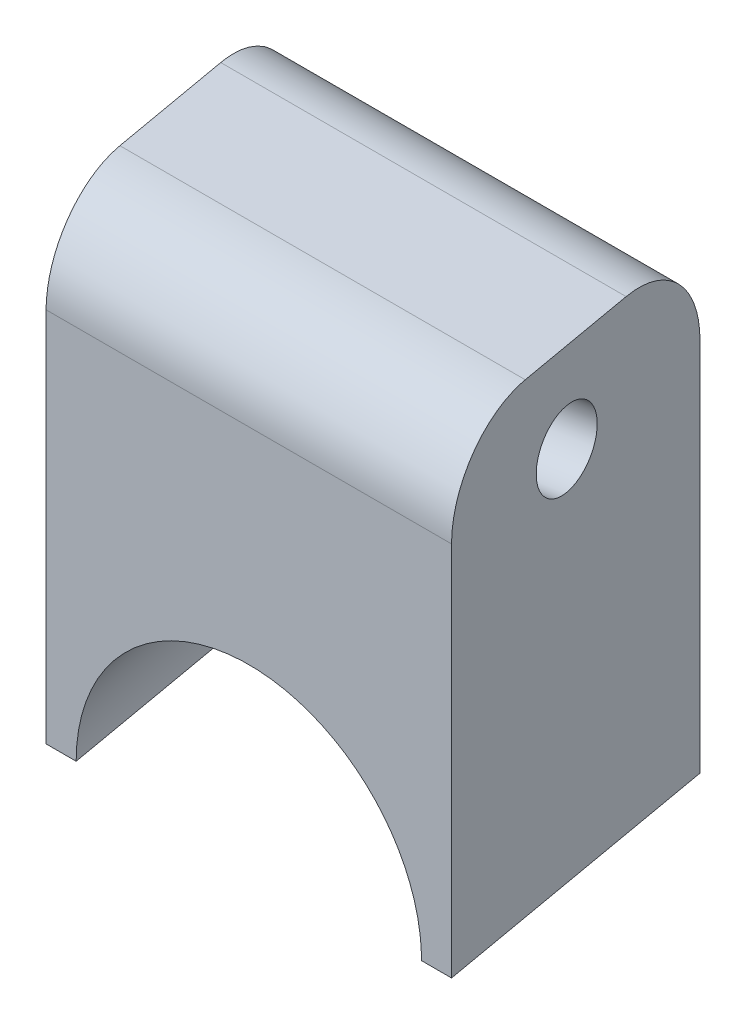
from build123d import *

# Parameters (mm, degrees)
BOSS_EXTRUDE1_DEPTH             = 26
CUT_EXTRUDE1_DEPTH              = 26
CUT_EXTRUDE2_DEPTH              = 26
FILLET1_R                       = 5
M5_TAPPED_HOLE1_D               = 4.2
M5_TAPPED_HOLE1_DEPTH           = 6
M5_TAPPED_HOLE1_TIP             = 1.2618073
M5_TAPPED_HOLE1_ON_FACE_2_D     = 4.2
M5_TAPPED_HOLE1_ON_FACE_2_DEPTH = 6
M5_TAPPED_HOLE1_ON_FACE_2_TIP   = 1.2618073


with BuildPart() as part:
    # 草图1 → Boss-Extrude1 (new body)
    with BuildSketch(Plane(origin=(0, 0, 0), x_dir=(1, 0, 0), z_dir=(0, 1, 0))):
        Polygon((35.23935759, 18.286975519), (57.88435759, 18.286975519), (54.914973752, 35.127188096), (32.269973752, 35.127188096), align=None)
        Polygon((35.23935759, 18.286975519), (35.922187891, 14.414452446), (57.88435759, 18.286975519), align=None)
    extrude(amount=BOSS_EXTRUDE1_DEPTH)

    # Sketch1 → Cut-Extrude1 (cut)
    with BuildSketch(Plane(origin=(-1.381830042, 0, -7.836747596), x_dir=(0.984807753012208, 0, -0.17364817766693116), z_dir=(0.17364817766693116, 0, 0.984807753012208))):
        with BuildLine():
            Line((39.529978324, 0), (58.529978324, 0))
            ThreePointArc((58.529978324, 0), (49.029978324, 9.5), (39.529978324, 0))
        make_face()
    extrude(amount=-CUT_EXTRUDE1_DEPTH, mode=Mode.SUBTRACT)

    # Sketch2 → Cut-Extrude2 (cut)
    with BuildSketch(Plane(origin=(0, 26, 0), x_dir=(1, 0, 0), z_dir=(0, 1, 0))):
        Polygon((35.23935759, 18.286975519), (35.922187891, 14.414452446), (57.88435759, 18.286975519), align=None)
    extrude(amount=-CUT_EXTRUDE2_DEPTH, mode=Mode.SUBTRACT)

    # Fillet1
    fillet1_edges = [part.edges().sort_by_distance(p)[0] for p in [
        (43.592473752, 26, -35.127188096),
        (46.56185759, 26, -18.286975519),
    ]]
    fillet(fillet1_edges, radius=FILLET1_R)

    # M5 Tapped Hole1
    with Locations(Plane(origin=(33.670475294, 21, -27.184549163), x_dir=(-0.173648177667, 0, -0.984807753012), z_dir=(-0.984807753012, 0, 0.173648177667))):
        with Locations((0, 0)):
            Hole(M5_TAPPED_HOLE1_D / 2, depth=M5_TAPPED_HOLE1_DEPTH)
            with Locations((0, 0, -(M5_TAPPED_HOLE1_DEPTH + M5_TAPPED_HOLE1_TIP / 2))):  # 118° drill point
                Cone(0, M5_TAPPED_HOLE1_D / 2, M5_TAPPED_HOLE1_TIP, mode=Mode.SUBTRACT)

    # M5 Tapped Hole1 on face 2
    with Locations(Plane(origin=(56.507099646, 21, -26.097793462), x_dir=(0.17364796312, 0, 0.984807790843), z_dir=(0.984807790843, 0, -0.17364796312))):
        with Locations((0, 0)):
            Hole(M5_TAPPED_HOLE1_ON_FACE_2_D / 2, depth=M5_TAPPED_HOLE1_ON_FACE_2_DEPTH)
            with Locations((0, 0, -(M5_TAPPED_HOLE1_ON_FACE_2_DEPTH + M5_TAPPED_HOLE1_ON_FACE_2_TIP / 2))):  # 118° drill point
                Cone(0, M5_TAPPED_HOLE1_ON_FACE_2_D / 2, M5_TAPPED_HOLE1_ON_FACE_2_TIP, mode=Mode.SUBTRACT)


solid = part.part
